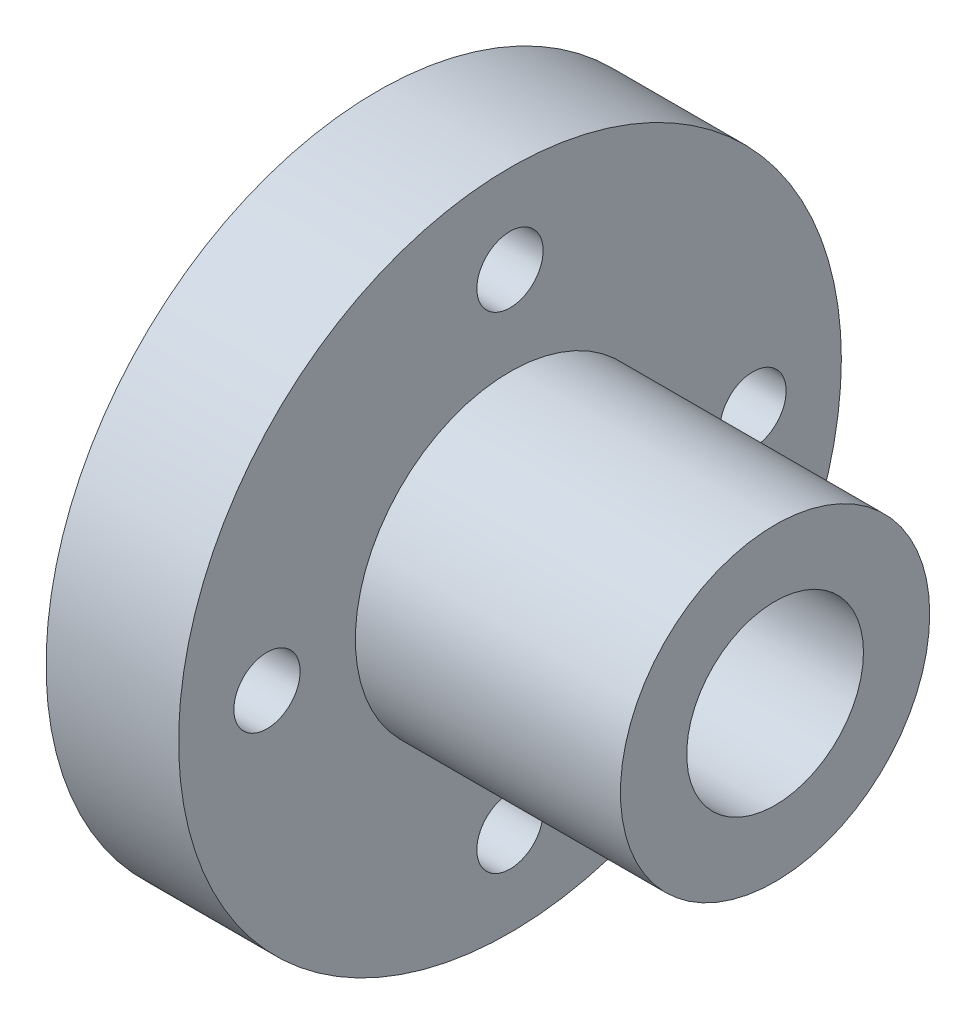
from build123d import *

# Parameters (mm, degrees)
SKETCH_2_R          = 1.5
CUT_EXTRUDE_1_DEPTH = 28.820855486


with BuildPart() as part:
    # Эскиз1 → Повернуть1 (revolve)
    with BuildSketch(Plane.XY, mode=Mode.PRIVATE) as revolve_1_sk:
        Polygon((0, 4), (0, 7), (2, 7), (2, 15), (8, 15), (8, 7), (20, 7), (20, 4), align=None)
    revolve(revolve_1_sk.sketch.rotate(Axis((8, 0, 0), (-1, 0, 0)), 90), axis=Axis((8, 0, 0), (-1, 0, 0)))

    # Эскиз2 → Вырез-Вытянуть1 (cut, through all)
    with BuildSketch(Plane.ZY.offset(-2)):
        with Locations((0, 11)):
            Circle(SKETCH_2_R)
        with Locations((-11, 0)):
            Circle(SKETCH_2_R)
        with Locations((0, -11)):
            Circle(SKETCH_2_R)
        with Locations((11, 0)):
            Circle(SKETCH_2_R)
    extrude(amount=-CUT_EXTRUDE_1_DEPTH, mode=Mode.SUBTRACT)


solid = part.part
